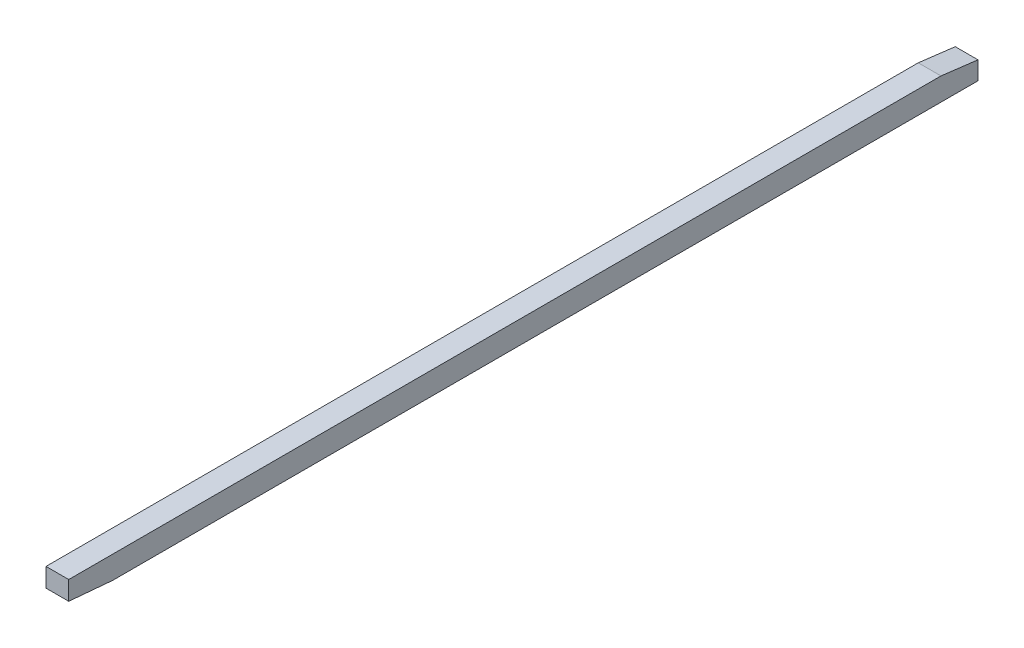
from build123d import *

# Parameters (mm, degrees)
SKETCH1_W           = 2.54
SKETCH1_H           = 2.54
BOSS_EXTRUDE1_DEPTH = 101.6
CHAMFER1_SIZE       = 4.92
CHAMFER1_SIZE2      = 0.430444225
CHAMFER2_SIZE       = 0.508
CHAMFER2_SIZE2      = 4.137327985


with BuildPart() as part:
    # Sketch1 → Boss-Extrude1 (new body)
    with BuildSketch(Plane.XY):
        with Locations((-1.27, 1.27)):
            Rectangle(SKETCH1_W, SKETCH1_H)
    extrude(amount=BOSS_EXTRUDE1_DEPTH)

    # Chamfer1
    chamfer1_edges = [part.edges().sort_by_distance(p)[0] for p in [
        (-1.27, 0, 101.6),
    ]]
    chamfer1_side = [part.faces().sort_by_distance(p)[0] for p in [
        (-1.27, 0, 50.8),
    ]]
    chamfer(chamfer1_edges, length=CHAMFER1_SIZE, length2=CHAMFER1_SIZE2, reference=chamfer1_side[0])

    # Chamfer2
    chamfer2_edges = [part.edges().sort_by_distance(p)[0] for p in [
        (-1.27, 2.54, 0),
    ]]
    chamfer2_side = [part.faces().sort_by_distance(p)[0] for p in [
        (-1.27, 1.27, 0),
    ]]
    chamfer(chamfer2_edges, length=CHAMFER2_SIZE, length2=CHAMFER2_SIZE2, reference=chamfer2_side[0])


solid = part.part
